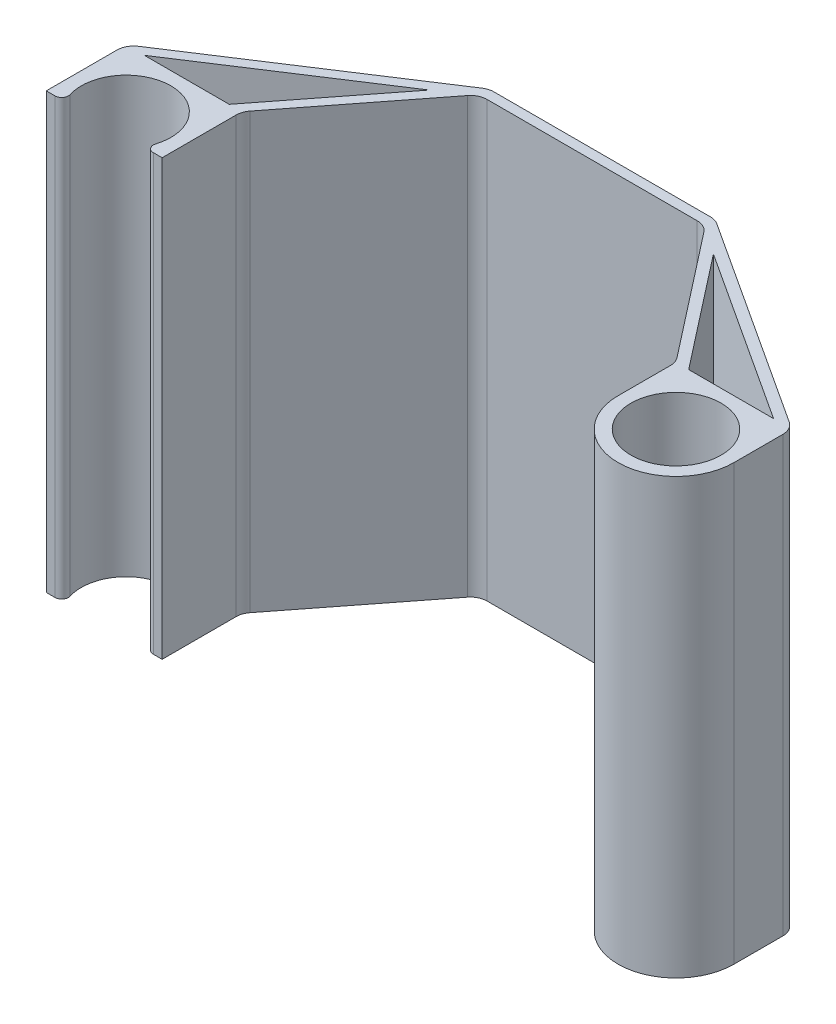
from build123d import *

# Parameters (mm, degrees)
BOSS_EXTRUDE1_DEPTH = 130.5
SKETCH4_W           = 34.8
SKETCH4_H           = 34.8
SKETCH4_R           = 13.45
BOSS_EXTRUDE2_DEPTH = 130.5
FILLET1_R           = 5
CUT_EXTRUDE4_DEPTH  = 182.887575167
SKETCH6_R           = 13.55
CUT_EXTRUDE5_DEPTH  = 182.887575167


with BuildPart() as part:
    # Sketch1 → Boss-Extrude1 (new body)
    with BuildSketch(Plane(origin=(0, 0, 0), x_dir=(1, 0, 0), z_dir=(0, 1, 0))):
        with BuildLine():
            Line((0, 0), (-34, 0))
            Line((-34, 0), (-100, -43))
            Line((-100, -43), (-100, -66.97))
            Line((-100, -66.97), (-97.358644924, -66.97))
            ThreePointArc((-97.358644924, -66.97), (-95.748804634, -66.156766295), (-95.448140727, -64.378414239))
            ThreePointArc((-95.448140727, -64.378414239), (-82.6, -46.95), (-69.751859273, -64.378414239))
            ThreePointArc((-69.751859273, -64.378414239), (-69.451195366, -66.156766295), (-67.841355076, -66.97))
            Line((-67.841355076, -66.97), (-65.2, -66.97))
            Line((-65.2, -66.97), (-65.2, -43))
            Line((-65.2, -43), (-34, -3))
            Line((-34, -3), (0, -3))
            Line((0, -3), (0, 0))
        make_face()
        Polygon((-69.004681327, -43), (-94.504291462, -43), (-42.656655328, -9.220479488), align=None, mode=Mode.SUBTRACT)
    boss_extrude1 = extrude(amount=BOSS_EXTRUDE1_DEPTH)

    # Mirror1: Boss-Extrude1 across plane
    add(boss_extrude1.mirror(Plane(origin=(0, 130.5, 3), x_dir=(0, 0, 1), z_dir=(-1, 0, 0))))

    # Sketch4 → Boss-Extrude2 (add)
    with BuildSketch(Plane.XZ):
        with Locations((82.6, 60.4)):
            Rectangle(SKETCH4_W, SKETCH4_H)
        with Locations(Location((82.6, 60.4, 0), (0, 0, 270))):
            Circle(SKETCH4_R, mode=Mode.SUBTRACT)
    extrude(amount=-BOSS_EXTRUDE2_DEPTH)

    # Fillet1
    fillet1_edges = [part.edges().sort_by_distance(p)[0] for p in [
        (-34, 65.25, 3),
        (-65.2, 65.25, 43),
        (-100, 65.25, 43),
        (-34, 65.25, 0),
        (34, 65.25, 3),
        (65.2, 65.25, 43),
        (100, 65.25, 43),
        (34, 65.25, 0),
    ]]
    fillet(fillet1_edges, radius=FILLET1_R)

    # Sketch5 → Cut-Extrude4 (cut, through all)
    with BuildSketch(Plane.XZ):
        with BuildLine():
            Line((65.2, 60.4), (65.2, 77.8))
            Line((65.2, 77.8), (83.070170915, 82.404410021))
            Line((83.070170915, 82.404410021), (100, 77.8))
            Line((100, 77.8), (100, 60.4))
            ThreePointArc((100, 60.4), (82.6, 77.8), (65.2, 60.4))
        make_face()
    extrude(amount=-CUT_EXTRUDE4_DEPTH, mode=Mode.SUBTRACT)

    # Sketch6 → Cut-Extrude5 (cut, through all)
    with BuildSketch(Plane.XZ):
        with Locations(Location((82.6, 60.4, 0), (0, 0, 270))):
            Circle(SKETCH6_R)
    extrude(amount=-CUT_EXTRUDE5_DEPTH, mode=Mode.SUBTRACT)


solid = part.part
